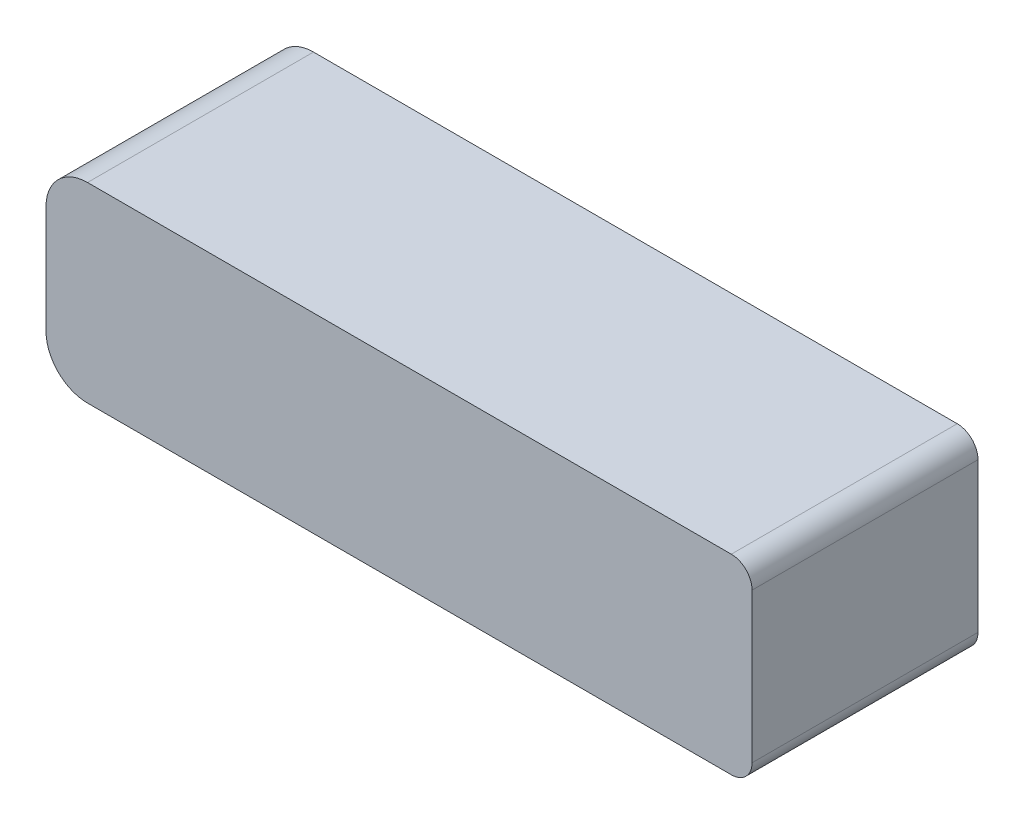
from build123d import *

# Parameters (mm, degrees)
BOSS_EXTRUDE1_DEPTH      = 14.605
BOSS_EXTRUDE1_DEPTH_BACK = 14.605
SKETCH1_W                = 107.95
SKETCH1_H                = 34.544
FILLET1_R                = 3.175
FILLET2_R                = 6.35


with BuildPart() as part:
    # Sketch1 → Boss-Extrude1 (new, two sides: drawn at the far end of the back side and taken through both)
    with BuildSketch(Plane(origin=(0, 0, 0), x_dir=(1, 0, 0), z_dir=(0, 1, 0)).offset(-BOSS_EXTRUDE1_DEPTH_BACK)):
        Rectangle(SKETCH1_W, SKETCH1_H)
    extrude(amount=BOSS_EXTRUDE1_DEPTH + BOSS_EXTRUDE1_DEPTH_BACK)

    # Fillet1
    fillet1_edges = [part.edges().sort_by_distance(p)[0] for p in [
        (53.975, -14.605, 0),
        (53.975, 14.605, 0),
    ]]
    fillet(fillet1_edges, radius=FILLET1_R)

    # Fillet2
    fillet2_edges = [part.edges().sort_by_distance(p)[0] for p in [
        (-53.975, 14.605, 0),
        (-53.975, -14.605, 0),
    ]]
    fillet(fillet2_edges, radius=FILLET2_R)


solid = part.part
